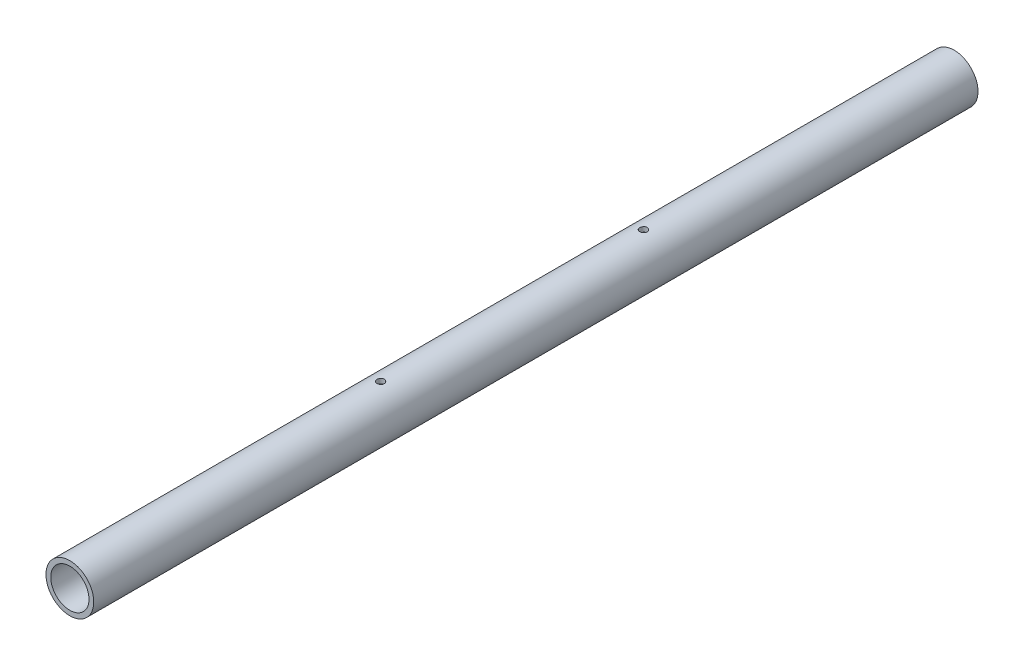
from build123d import *

# Parameters (mm, degrees)
SKETCH_1_R               = 10
SKETCH_1_R_2             = 8
EXTRUDE_1_DEPTH          = 370
CUT_EXTRUDE_1_DEPTH      = 371.270171631
CUT_EXTRUDE_1_DEPTH_BACK = 371.270171631
SKETCH_2_R               = 1.55


with BuildPart() as part:
    # 草图1 → 凸台-拉伸1 (new body)
    with BuildSketch(Plane.XY):
        Circle(SKETCH_1_R)
        Circle(SKETCH_1_R_2, mode=Mode.SUBTRACT)
    extrude(amount=EXTRUDE_1_DEPTH)

    # 草图2 → 切除-拉伸1 (cut, two sides: drawn at the far end of the back side and taken through both)
    with BuildSketch(Plane(origin=(0, 0, 0), x_dir=(1, 0, 0), z_dir=(0, 1, 0)).offset(-CUT_EXTRUDE_1_DEPTH_BACK)):
        with Locations(Location((0, -130, 0), (0, 0, 270))):
            Circle(SKETCH_2_R)
        with Locations(Location((0, -240, 0), (0, 0, 270))):
            Circle(SKETCH_2_R)
    extrude(amount=CUT_EXTRUDE_1_DEPTH + CUT_EXTRUDE_1_DEPTH_BACK, mode=Mode.SUBTRACT)


solid = part.part
